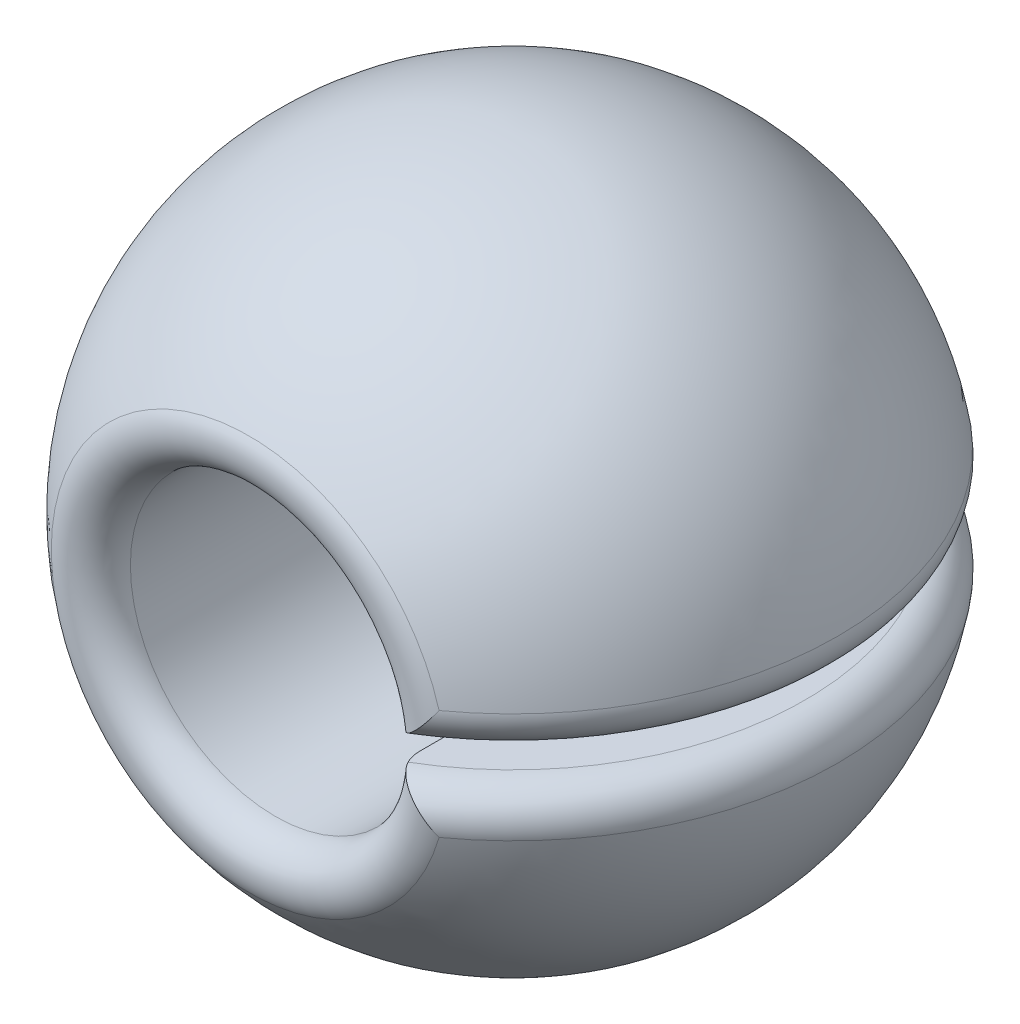
from build123d import *

# Parameters (mm, degrees)
SKETCH_2_R          = 4.4
CUT_EXTRUDE_1_DEPTH = 15
SKETCH_3_W          = 10.421641006
SKETCH_3_H          = 1
CUT_EXTRUDE_2_DEPTH = 15
FILLET_1_R          = 1


with BuildPart() as part:
    # 스케치1 → 회전2 (revolve)
    with BuildSketch(Plane.XY):
        with BuildLine():
            Line((0, 10), (0, -10))
            ThreePointArc((0, -10), (-10, 0), (0, 10))
        make_face()
    revolve(axis=Axis((0, 11.789684906, 0), (0, -1, 0)))

    # 스케치2 → 컷-돌출1 (cut, symmetric)
    with BuildSketch(Plane.XY):
        with Locations(Location((0, 0, 0), (0, 0, 180))):
            Circle(SKETCH_2_R)
    extrude(amount=CUT_EXTRUDE_1_DEPTH, both=True, mode=Mode.SUBTRACT)

    # 스케치3 → 컷-돌출2 (cut, symmetric)
    with BuildSketch(Plane.XY):
        with Locations((6.647452601, 0)):
            Rectangle(SKETCH_3_W, SKETCH_3_H)
    extrude(amount=CUT_EXTRUDE_2_DEPTH, both=True, mode=Mode.SUBTRACT)

    # 필렛1
    fillet_1_edges = [part.edges().sort_by_distance(p)[0] for p in [
        (-0.250405834, -4.392868837, 8.979977728),
        (9.987492178, 0.5, 0),
        (9.987492178, -0.5, 0),
        (-0.250405834, -4.392868837, -8.979977728),
    ]]
    fillet(fillet_1_edges, radius=FILLET_1_R)


solid = part.part
